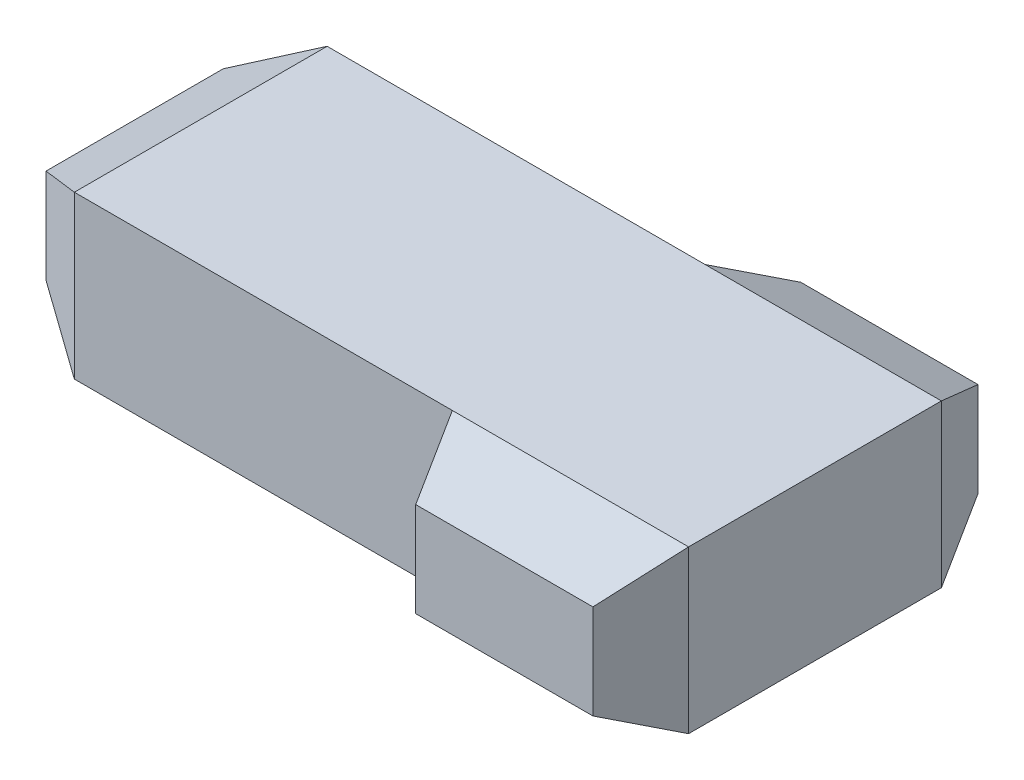
from build123d import *

# Parameters (mm, degrees)
SKETCH1_W           = 26
SKETCH1_H           = 10.7
BOSS_EXTRUDE1_DEPTH = 6.85


with BuildPart() as part:
    # Sketch1 → Boss-Extrude1 (new body)
    with BuildSketch(Plane(origin=(0, 0, 0), x_dir=(1, 0, 0), z_dir=(0, 1, 0))):
        Rectangle(SKETCH1_W, SKETCH1_H)
    extrude(amount=BOSS_EXTRUDE1_DEPTH)

    # Sketch2 → section 0 of loft1
    with BuildSketch(Plane.ZY.offset(15.8), mode=Mode.PRIVATE) as loft1_s0:
        with BuildLine():
            Line((3.75, 1.425), (-3.75, 1.425))
            Line((-3.75, 1.425), (-3.75, 5.425))
            Line((-3.75, 5.425), (3.75, 5.425))
            Line((3.75, 5.425), (3.75, 1.425))
        make_face()
    # loft up to a face of the part (loft1)
    loft([loft1_s0.sketch, part.faces().sort_by_distance((-13, 3.425, 0))[0]])

    # Sketch4 → Loft2 section 0
    with BuildSketch(Plane.XY.offset(5.35)):
        with BuildLine():
            Line((13, 6.85), (3, 6.85))
            Line((3, 6.85), (3, 0))
            Line((3, 0), (13, 0))
            Line((13, 0), (13, 6.85))
        make_face()
    # Sketch3 → Loft2 section 1
    with BuildSketch(Plane.XY.offset(8.15)):
        with BuildLine():
            Line((4.25, 1.425), (11.75, 1.425))
            Line((11.75, 1.425), (11.75, 5.425))
            Line((11.75, 5.425), (4.25, 5.425))
            Line((4.25, 5.425), (4.25, 1.425))
        make_face()
    loft2 = loft()

    # Mirror1: Loft2 across plane
    add(loft2.mirror(Plane.XY))


solid = part.part
